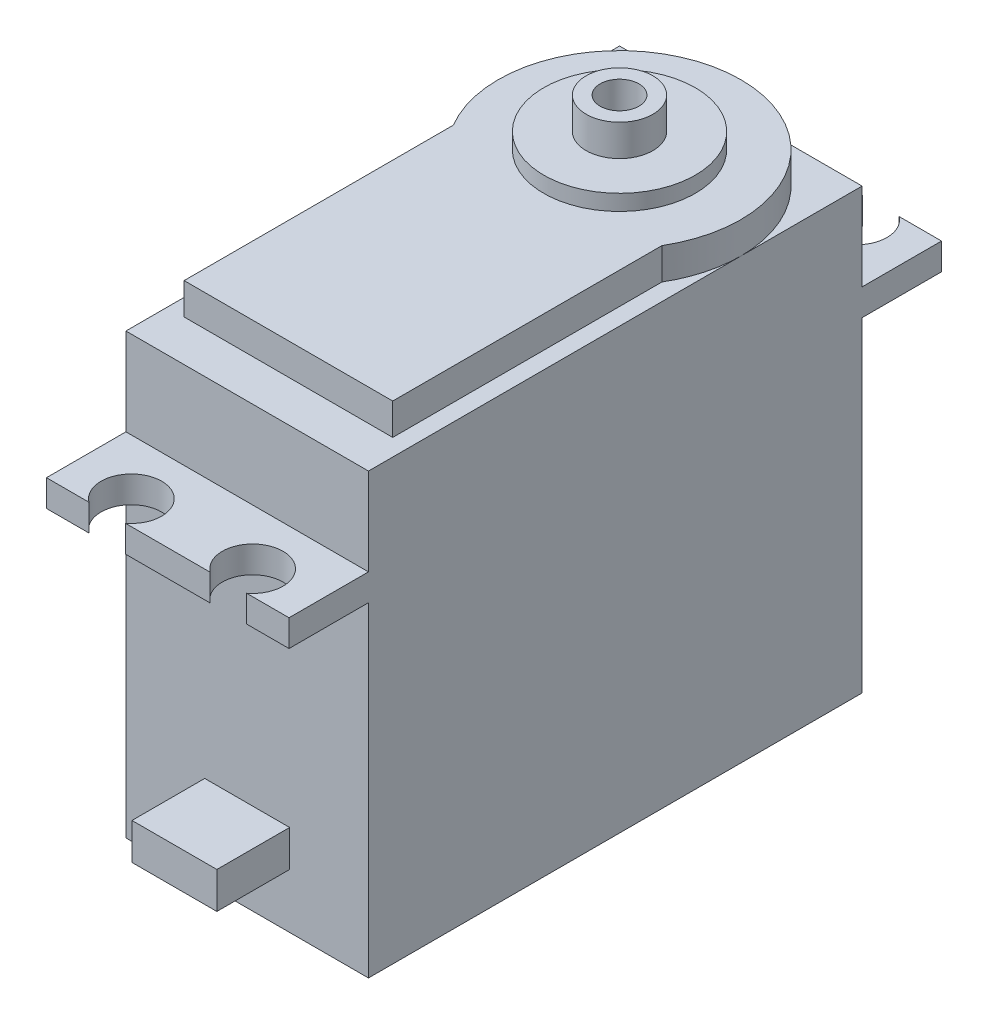
from build123d import *

# Parameters (mm, degrees)
SKETCH1_W           = 40.7
SKETCH1_H           = 36.2
BOSS_EXTRUDE1_DEPTH = 20
SKETCH2_W           = 6.55
SKETCH2_H           = 2.2
BOSS_EXTRUDE2_DEPTH = 20
SKETCH3_R           = 6.25
BOSS_EXTRUDE3_DEPTH = 38.8
SKETCH3_3_R         = 6.25
SKETCH3_3_R_2       = 2.75
SKETCH3_3_R_3       = 1.6
BOSS_EXTRUDE4_DEPTH = 40.1
SKETCH3_4_R         = 2.75
SKETCH3_4_R_2       = 1.6
BOSS_EXTRUDE5_DEPTH = 42.7
SKETCH5_R           = 2.5
CUT_EXTRUDE1_DEPTH  = 43.9
SKETCH8_R           = 2.5
CUT_EXTRUDE2_DEPTH  = 43.9
SKETCH10_R          = 2.5
CUT_EXTRUDE3_DEPTH  = 43.9
SKETCH12_W          = 7
SKETCH12_H          = 1.5
BOSS_EXTRUDE6_DEPTH = 6


with BuildPart() as part:
    # Sketch1 → Boss-Extrude1 (new body)
    with BuildSketch(Plane(origin=(0, 0, 0), x_dir=(0, 0, -1), z_dir=(1, 0, 0))):
        with Locations((-15.995997066, 21.093377017)):
            Rectangle(SKETCH1_W, SKETCH1_H)
    extrude(amount=BOSS_EXTRUDE1_DEPTH)

    # Sketch2 → Boss-Extrude2 (add)
    with BuildSketch(Plane(origin=(0, 0, 0), x_dir=(0, 0, -1), z_dir=(1, 0, 0))):
        with Locations((-39.620997066, 30.893377017)):
            Rectangle(SKETCH2_W, SKETCH2_H)
        with Locations((7.629002934, 30.893377017)):
            Rectangle(SKETCH2_W, SKETCH2_H)
    extrude(amount=BOSS_EXTRUDE2_DEPTH)

    # Sketch3 → Boss-Extrude3 (add)
    with BuildSketch(Plane(origin=(0, 2.993377017, 0), x_dir=(1, 0, 0), z_dir=(0, 1, 0))):
        with BuildLine():
            Line((1.4, -10.748937395), (1.4, -32.945997066))
            Line((1.4, -32.945997066), (18.6, -32.945997066))
            Line((18.6, -32.945997066), (18.6, -10.748937395))
            ThreePointArc((18.6, -10.748937395), (10, 4.354002934), (1.4, -10.748937395))
        make_face()
        with Locations(Location((10, -5.645997066, 0), (0, 0, 90))):
            Circle(SKETCH3_R, mode=Mode.SUBTRACT)
    extrude(amount=BOSS_EXTRUDE3_DEPTH)

    # Sketch3<3> → Boss-Extrude4 (add)
    # profile 1 of 2: a face of its own
    with BuildSketch(Plane(origin=(0, 2.993377017, 0), x_dir=(1, 0, 0), z_dir=(0, 1, 0))):
        with Locations(Location((10, -5.645997066, 0), (0, 0, 90))):
            Circle(SKETCH3_3_R)
        with Locations(Location((10, -5.645997066, 0), (0, 0, 90))):
            Circle(SKETCH3_3_R_2, mode=Mode.SUBTRACT)
    # profile 2 of 2: a face of its own
    with BuildSketch(Plane(origin=(0, 2.993377017, 0), x_dir=(1, 0, 0), z_dir=(0, 1, 0))):
        with Locations(Location((10, -5.645997066, 0), (0, 0, 90))):
            Circle(SKETCH3_3_R_3)
    extrude(amount=BOSS_EXTRUDE4_DEPTH)

    # Sketch3<4> → Boss-Extrude5 (add)
    with BuildSketch(Plane(origin=(0, 2.993377017, 0), x_dir=(1, 0, 0), z_dir=(0, 1, 0))):
        with Locations(Location((10, -5.645997066, 0), (0, 0, 90))):
            Circle(SKETCH3_4_R)
        with Locations(Location((10, -5.645997066, 0), (0, 0, 90))):
            Circle(SKETCH3_4_R_2, mode=Mode.SUBTRACT)
    extrude(amount=BOSS_EXTRUDE5_DEPTH)

    # Sketch5 → Cut-Extrude1 (cut)
    with BuildSketch(Plane(origin=(0, 0, 0), x_dir=(1, 0, 0), z_dir=(0, 1, 0))):
        with Locations((15, -40.895997066)):
            Circle(SKETCH5_R)
    extrude(amount=CUT_EXTRUDE1_DEPTH, mode=Mode.SUBTRACT)

    # Sketch8 → Cut-Extrude2 (cut)
    with BuildSketch(Plane(origin=(0, 31.993377017, 0), x_dir=(1, 0, 0), z_dir=(0, 1, 0))):
        with Locations((5, -40.895997066)):
            Circle(SKETCH8_R)
    extrude(amount=-CUT_EXTRUDE2_DEPTH, mode=Mode.SUBTRACT)

    # Sketch10 → Cut-Extrude3 (cut)
    with BuildSketch(Plane(origin=(0, 0, 0), x_dir=(1, 0, 0), z_dir=(0, 1, 0))):
        with Locations((5, 8.904002934)):
            Circle(SKETCH10_R)
        with Locations((15, 8.904002934)):
            Circle(SKETCH10_R)
    extrude(amount=CUT_EXTRUDE3_DEPTH, mode=Mode.SUBTRACT)

    # Sketch12 → Boss-Extrude6 (add)
    with BuildSketch(Plane.XY.offset(36.345997066)):
        with Locations((10, 9.743377017)):
            Rectangle(SKETCH12_W, SKETCH12_H)
        with Locations((10, 8.243377017)):
            Rectangle(SKETCH12_W, SKETCH12_H)
    extrude(amount=BOSS_EXTRUDE6_DEPTH)


solid = part.part
